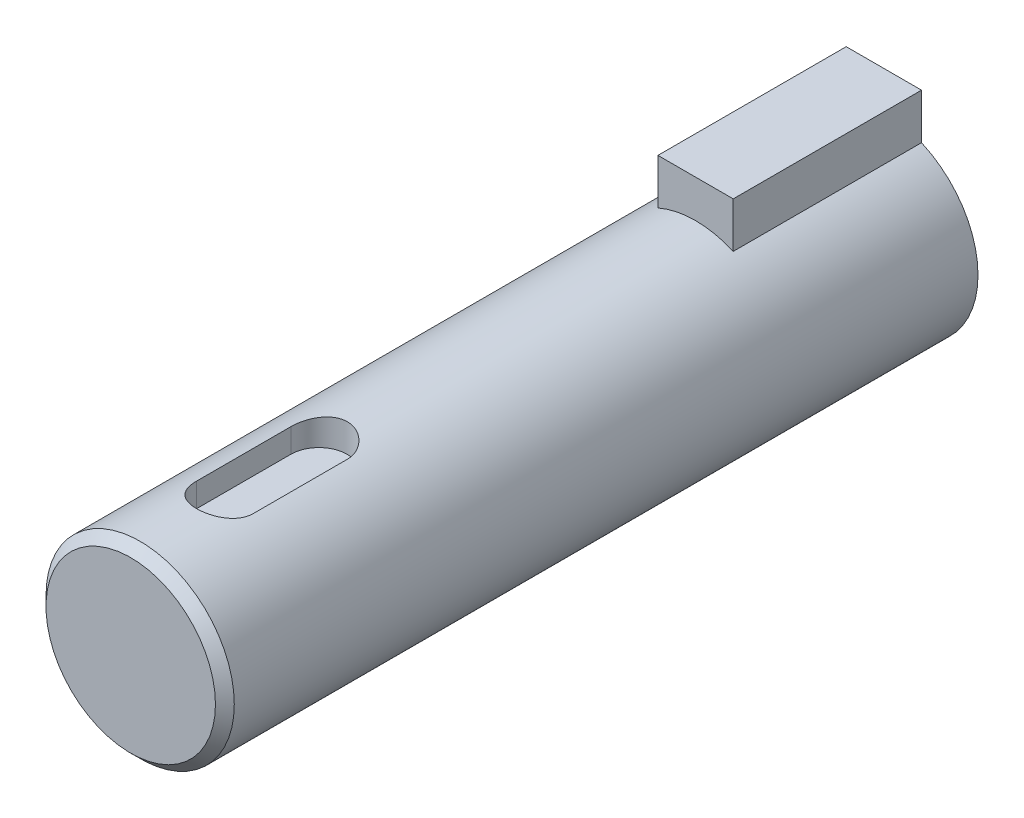
from build123d import *

# Parameters (mm, degrees)
BOSS_EXTRUDE1_DEPTH = 10
SKETCH2_R           = 5
BOSS_EXTRUDE2_DEPTH = 30
CUT_EXTRUDE1_START  = 3.5
CUT_EXTRUDE1_DEPTH  = 38.414545091
CHAMFER1_SIZE       = 0.5


with BuildPart() as part:
    # Sketch1 → Boss-Extrude1 (new body)
    with BuildSketch(Plane.XY):
        with BuildLine():
            Line((2, 7), (-2, 7))
            Line((-2, 7), (-2, 4.582575695))
            ThreePointArc((-2, 4.582575695), (0, -5), (2, 4.582575695))
            Line((2, 4.582575695), (2, 7))
        make_face()
    extrude(amount=BOSS_EXTRUDE1_DEPTH)

    # Sketch2 → Boss-Extrude2 (add)
    with BuildSketch(Plane.XY.offset(10)):
        with Locations(Location((0, 0, 0), (0, 0, 113.578178478))):
            Circle(SKETCH2_R)
    extrude(amount=BOSS_EXTRUDE2_DEPTH)

    # Sketch3 → Cut-Extrude1 (cut, through all)
    with BuildSketch(Plane(origin=(0, 0, 0), x_dir=(1, 0, 0), z_dir=(0, 1, 0)).offset(CUT_EXTRUDE1_START)):
        with BuildLine():
            Line((1.5, -30), (1.5, -35))
            ThreePointArc((1.5, -35), (0, -36.5), (-1.5, -35))
            Line((-1.5, -35), (-1.5, -30))
            ThreePointArc((-1.5, -30), (0, -28.5), (1.5, -30))
        make_face()
    extrude(amount=CUT_EXTRUDE1_DEPTH, mode=Mode.SUBTRACT)

    # Chamfer1
    chamfer1_edges = [part.edges().sort_by_distance(p)[0] for p in [
        (2, -4.582575695, 40),
    ]]
    chamfer(chamfer1_edges, length=CHAMFER1_SIZE)


solid = part.part
